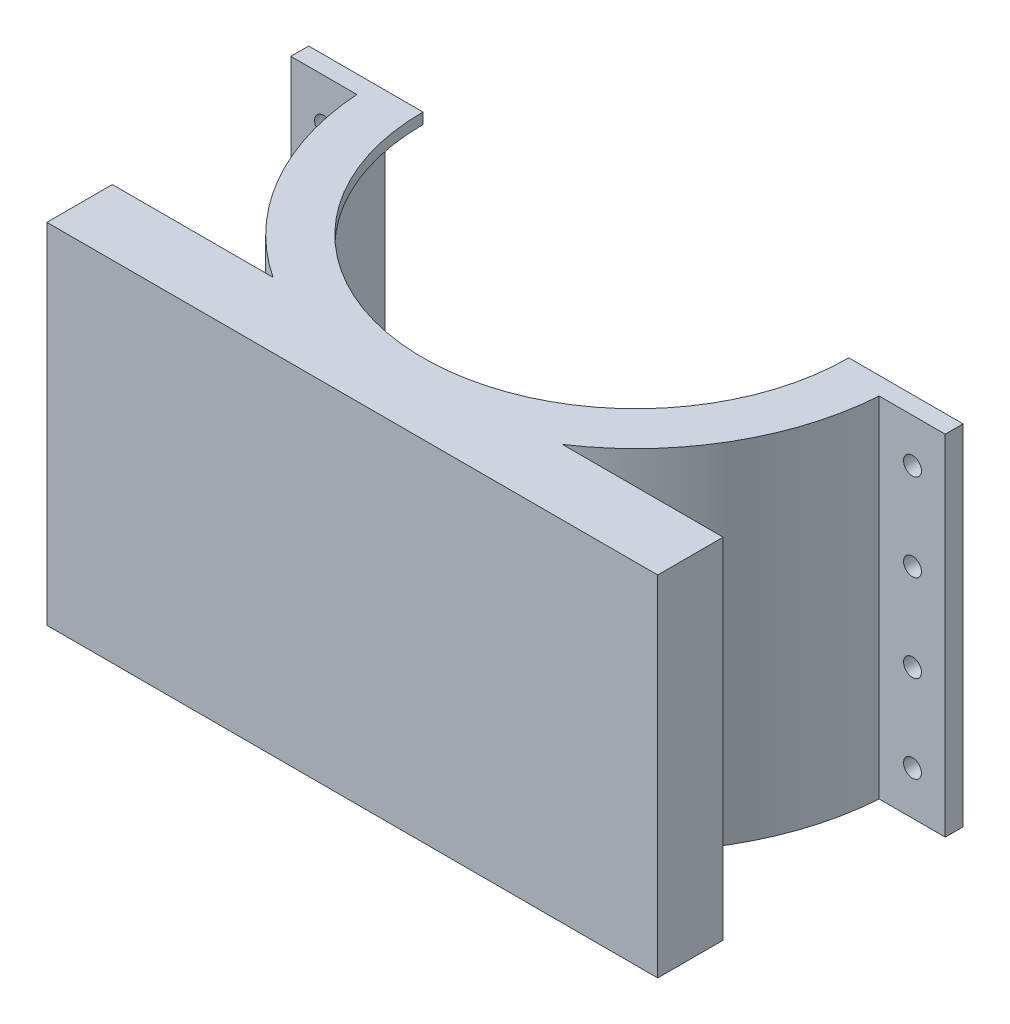
from build123d import *

# Parameters (mm, degrees)
BOSS_EXTRUDE2_DEPTH = 4
CUT_EXTRUDE1_DEPTH  = 3.75
CUT_EXTRUDE2_START  = 7.5
CUT_EXTRUDE2_DEPTH  = 7.5
SKETCH2_R           = 0.205
CUT_EXTRUDE3_DEPTH  = 7.5


with BuildPart() as part:
    # Sketch1 → Boss-Extrude2 (new, symmetric)
    with BuildSketch(Plane(origin=(0, 0, 0), x_dir=(1, 0, 0), z_dir=(0, 1, 0))):
        with BuildLine():
            Line((-7.5, 0), (-7.5, -0.41))
            Line((-7.5, -0.41), (-5.985975276, -0.41))
            ThreePointArc((-5.985975276, -0.41), (-5.186676874, -3.016352599), (-3.31662479, -5))
            Line((-3.31662479, -5), (-7, -5))
            Line((-7, -5), (-7, -6.5))
            Line((-7, -6.5), (7, -6.5))
            Line((7, -6.5), (7, -5))
            Line((7, -5), (3.31662479, -5))
            ThreePointArc((3.31662479, -5), (5.186676874, -3.016352599), (5.985975276, -0.41))
            Line((5.985975276, -0.41), (7.5, -0.41))
            Line((7.5, -0.41), (7.5, 0))
            Line((7.5, 0), (1.5, 0))
            ThreePointArc((1.5, 0), (0, -1.5), (-1.5, 0))
            Line((-1.5, 0), (-7.5, 0))
        make_face()
    extrude(amount=BOSS_EXTRUDE2_DEPTH, both=True)

    # Sketch1<3> → Cut-Extrude1 (cut, symmetric)
    with BuildSketch(Plane(origin=(0, 0, 0), x_dir=(1, 0, 0), z_dir=(0, 1, 0))):
        with BuildLine():
            ThreePointArc((-5.75, 0), (0, -5.75), (5.75, 0))
            Line((5.75, 0), (1.5, 0))
            ThreePointArc((1.5, 0), (0, -1.5), (-1.5, 0))
            Line((-1.5, 0), (-5.75, 0))
        make_face()
    extrude(amount=CUT_EXTRUDE1_DEPTH, both=True, mode=Mode.SUBTRACT)

    # Sketch1<4> → Cut-Extrude2 (cut)
    with BuildSketch(Plane(origin=(0, 0, 0), x_dir=(1, 0, 0), z_dir=(0, 1, 0)).offset(CUT_EXTRUDE2_START)):
        with BuildLine():
            Line((-1.5, 0), (-4.88, 0))
            ThreePointArc((-4.88, 0), (0, -4.88), (4.88, 0))
            Line((4.88, 0), (1.5, 0))
            ThreePointArc((1.5, 0), (0, -1.5), (-1.5, 0))
        make_face()
    extrude(amount=-CUT_EXTRUDE2_DEPTH, mode=Mode.SUBTRACT)

    # Sketch2 → Cut-Extrude3 (cut)
    with BuildSketch(Plane.XY.offset(0.41)):
        with Locations((-6.75, 3)):
            Circle(SKETCH2_R)
        with Locations((-6.75, 1)):
            Circle(SKETCH2_R)
        with Locations((-6.75, -1)):
            Circle(SKETCH2_R)
        with Locations((-6.75, -3)):
            Circle(SKETCH2_R)
        with Locations((6.75, -3)):
            Circle(SKETCH2_R)
        with Locations((6.75, -1)):
            Circle(SKETCH2_R)
        with Locations((6.75, 1)):
            Circle(SKETCH2_R)
        with Locations((6.75, 3)):
            Circle(SKETCH2_R)
    extrude(amount=-CUT_EXTRUDE3_DEPTH, mode=Mode.SUBTRACT)


solid = part.part
